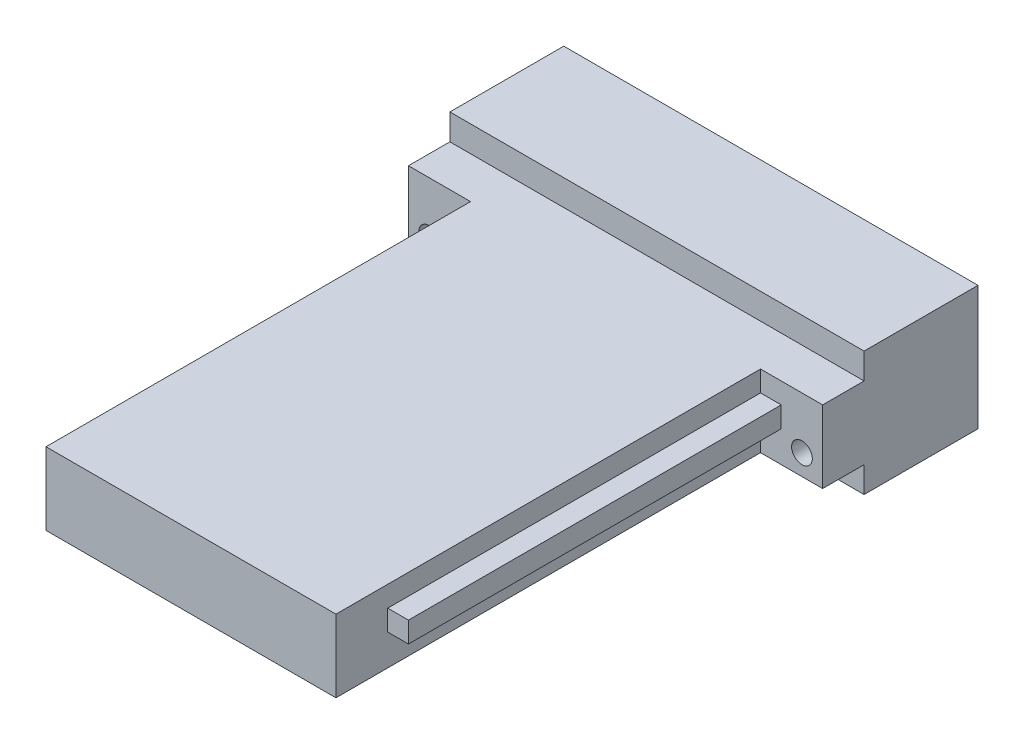
from build123d import *

# Parameters (mm, degrees)
SKETCH1_W            = 28
SKETCH1_H            = 45
BOSS_EXTRUDE1_DEPTH  = 7
SKETCH7_W            = 4
SKETCH7_H            = 7
BOSS_EXTRUDE2_DEPTH  = 6
SKETCH6_W            = 4
SKETCH6_H            = 7
BOSS_EXTRUDE3_DEPTH  = 6
SKETCH10_R           = 1
CUT_EXTRUDE1_DEPTH   = 6
SKETCH11_W           = 24
SKETCH11_H           = 5
CUT_EXTRUDE2_DEPTH   = 43
SKETCH16_W           = 36
SKETCH16_H           = 2
BOSS_EXTRUDE7_DEPTH  = 2
SKETCH17_W           = 36
SKETCH17_H           = 2
BOSS_EXTRUDE8_DEPTH  = 2
SKETCH30_W           = 40
SKETCH30_H           = 12
BOSS_EXTRUDE13_DEPTH = 11
SKETCH31_W           = 24
SKETCH31_H           = 10
CUT_EXTRUDE11_DEPTH  = 10
SKETCH32_W           = 24
SKETCH32_H           = 5
CUT_EXTRUDE12_DEPTH  = 1
SKETCH33_R           = 1
CUT_EXTRUDE13_DEPTH  = 11
SKETCH34_R           = 1
CUT_EXTRUDE14_DEPTH  = 11


with BuildPart() as part:
    # Sketch1 → Boss-Extrude1 (new body)
    with BuildSketch(Plane(origin=(0, 0, 0), x_dir=(1, 0, 0), z_dir=(0, 1, 0))):
        with Locations((14, 22.5)):
            Rectangle(SKETCH1_W, SKETCH1_H)
    extrude(amount=BOSS_EXTRUDE1_DEPTH)

    # Sketch7 → Boss-Extrude2 (add)
    with BuildSketch(Plane(origin=(28, 0, 0), x_dir=(0, 0, -1), z_dir=(1, 0, 0))):
        with Locations((43, 3.5)):
            Rectangle(SKETCH7_W, SKETCH7_H)
    extrude(amount=BOSS_EXTRUDE2_DEPTH)

    # Sketch6 → Boss-Extrude3 (add)
    with BuildSketch(Plane.ZY):
        with Locations((-43, 3.5)):
            Rectangle(SKETCH6_W, SKETCH6_H)
    extrude(amount=BOSS_EXTRUDE3_DEPTH)

    # Sketch10 → Cut-Extrude1 (cut)
    with BuildSketch(Plane.XY.offset(-41)):
        with Locations((-4, 2)):
            Circle(SKETCH10_R)
        with Locations((32, 2)):
            Circle(SKETCH10_R)
    extrude(amount=-CUT_EXTRUDE1_DEPTH, mode=Mode.SUBTRACT)

    # Sketch11 → Cut-Extrude2 (cut)
    with BuildSketch(Plane(origin=(0, 0, -45), x_dir=(-1, 0, 0), z_dir=(0, 0, -1))):
        with Locations((-14, 3.5)):
            Rectangle(SKETCH11_W, SKETCH11_H)
    extrude(amount=-CUT_EXTRUDE2_DEPTH, mode=Mode.SUBTRACT)

    # Sketch16 → Boss-Extrude7 (add)
    with BuildSketch(Plane.ZY):
        with Locations((-23, 4)):
            Rectangle(SKETCH16_W, SKETCH16_H)
    extrude(amount=BOSS_EXTRUDE7_DEPTH)

    # Sketch17 → Boss-Extrude8 (add)
    with BuildSketch(Plane(origin=(28, 0, 0), x_dir=(0, 0, -1), z_dir=(1, 0, 0))):
        with Locations((23, 4)):
            Rectangle(SKETCH17_W, SKETCH17_H)
    extrude(amount=BOSS_EXTRUDE8_DEPTH)

    # Sketch30 → Boss-Extrude13 (add)
    with BuildSketch(Plane(origin=(0, 0, -45), x_dir=(-1, 0, 0), z_dir=(0, 0, -1))):
        with Locations((-14, 3.5)):
            Rectangle(SKETCH30_W, SKETCH30_H)
    extrude(amount=BOSS_EXTRUDE13_DEPTH)

    # Sketch31 → Cut-Extrude11 (cut)
    with BuildSketch(Plane(origin=(0, 0, -56), x_dir=(-1, 0, 0), z_dir=(0, 0, -1))):
        with Locations((-14, 3.5)):
            Rectangle(SKETCH31_W, SKETCH31_H)
    extrude(amount=-CUT_EXTRUDE11_DEPTH, mode=Mode.SUBTRACT)

    # Sketch32 → Cut-Extrude12 (cut)
    with BuildSketch(Plane(origin=(0, 0, -46), x_dir=(-1, 0, 0), z_dir=(0, 0, -1))):
        with Locations((-14, 3.5)):
            Rectangle(SKETCH32_W, SKETCH32_H)
    extrude(amount=-CUT_EXTRUDE12_DEPTH, mode=Mode.SUBTRACT)

    # Sketch33 → Cut-Extrude13 (cut)
    with BuildSketch(Plane.XY.offset(-45)):
        with Locations((32, 2)):
            Circle(SKETCH33_R)
    extrude(amount=-CUT_EXTRUDE13_DEPTH, mode=Mode.SUBTRACT)

    # Sketch34 → Cut-Extrude14 (cut)
    with BuildSketch(Plane.XY.offset(-45)):
        with Locations((-4, 2)):
            Circle(SKETCH34_R)
    extrude(amount=-CUT_EXTRUDE14_DEPTH, mode=Mode.SUBTRACT)


solid = part.part
